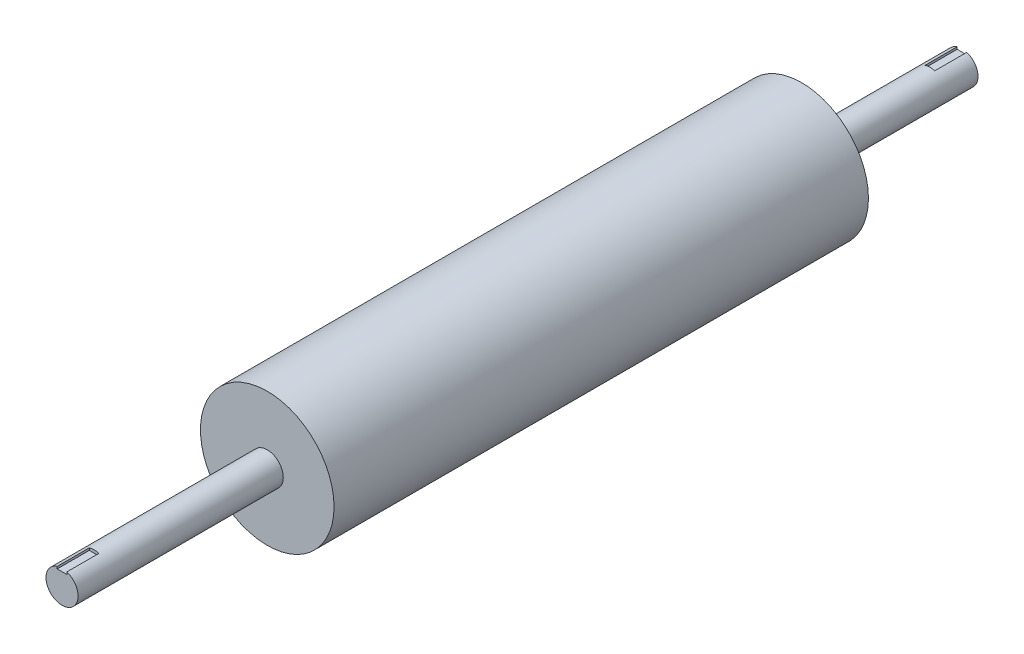
from build123d import *

# Parameters (mm, degrees)
SKETCH2_R           = 125
BOSS_EXTRUDE1_DEPTH = 1000
SKETCH7_R           = 30
BOSS_EXTRUDE3_DEPTH = 384.03
BOSS_EXTRUDE4_START = 300
SKETCH8_R           = 30
BOSS_EXTRUDE4_DEPTH = 300
SKETCH18_W          = 18
SKETCH18_H          = 11
CUT_EXTRUDE2_DEPTH  = 60
SKETCH19_W          = 18
SKETCH19_H          = 11
CUT_EXTRUDE3_DEPTH  = 60


with BuildPart() as part:
    # Sketch2 → Boss-Extrude1 (new body)
    with BuildSketch(Plane.XY):
        Circle(SKETCH2_R)
    extrude(amount=BOSS_EXTRUDE1_DEPTH)

    # Sketch7 → Boss-Extrude3 (add)
    with BuildSketch(Plane.XY.offset(1000)):
        Circle(SKETCH7_R)
    extrude(amount=BOSS_EXTRUDE3_DEPTH)

    # Sketch8 → Boss-Extrude4 (add)
    with BuildSketch(Plane(origin=(0, 0, 0), x_dir=(-1, 0, 0), z_dir=(0, 0, -1)).offset(BOSS_EXTRUDE4_START)):
        with Locations(Location((0, 0, 0), (0, 0, 180))):
            Circle(SKETCH8_R)
    extrude(amount=-BOSS_EXTRUDE4_DEPTH)

    # Sketch18 → Cut-Extrude2 (cut)
    with BuildSketch(Plane.XY.offset(1384.03)):
        with Locations((0, 30)):
            Rectangle(SKETCH18_W, SKETCH18_H)
    extrude(amount=-CUT_EXTRUDE2_DEPTH, mode=Mode.SUBTRACT)

    # Sketch19 → Cut-Extrude3 (cut)
    with BuildSketch(Plane(origin=(0, 0, -300), x_dir=(-1, 0, 0), z_dir=(0, 0, -1))):
        with Locations((0, 30)):
            Rectangle(SKETCH19_W, SKETCH19_H)
    extrude(amount=-CUT_EXTRUDE3_DEPTH, mode=Mode.SUBTRACT)


solid = part.part
